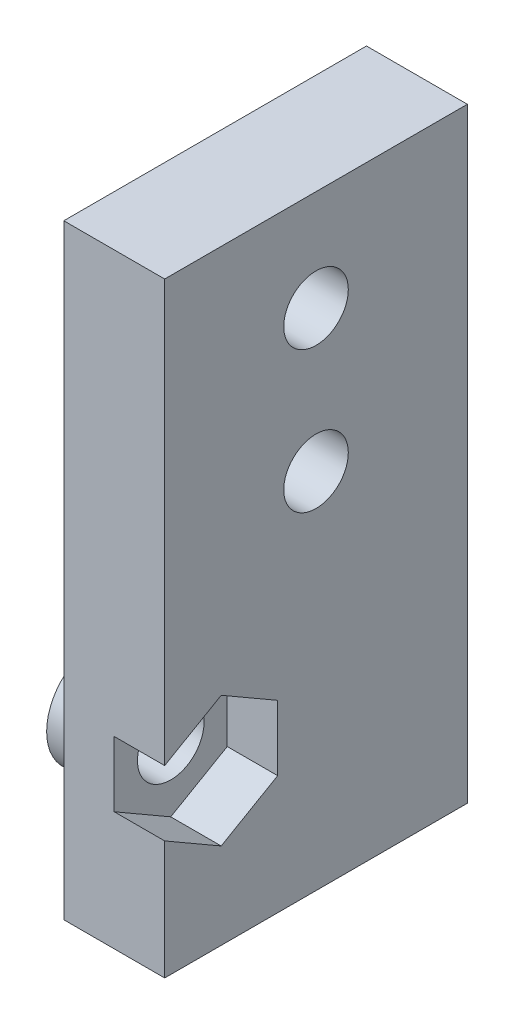
from build123d import *
from build123d.topology import SkipClean

# Parameters (mm, degrees)
SKETCH1_R           = 1.6
BOSS_EXTRUDE1_DEPTH = 2.5
BOSS_EXTRUDE2_START = -2.5
SKETCH1_3_R         = 1.6
SKETCH1_3_R_2       = 1.65
BOSS_EXTRUDE2_DEPTH = 2.5
BOSS_EXTRUDE3_START = 1
SKETCH4_R           = 2.65
SKETCH4_R_2         = 1.65
BOSS_EXTRUDE3_DEPTH = 1


with BuildPart() as part:
    # Sketch1 → Boss-Extrude1 (new body)
    with BuildSketch(Plane(origin=(0, 0, 0), x_dir=(0, 0, -1), z_dir=(1, 0, 0))):
        Polygon((0, 5.883419246), (0, 0), (15, 0), (15, 30), (0, 30), (0, 9.116580754), (2.8, 10.733161507), (5.6, 9.116580754), (5.6, 5.883419246), (2.8, 4.266838493), align=None)
        with Locations((7.5, 18)):
            Circle(SKETCH1_R, mode=Mode.SUBTRACT)
        with Locations((7.5, 25)):
            Circle(SKETCH1_R, mode=Mode.SUBTRACT)
    extrude(amount=BOSS_EXTRUDE1_DEPTH)

    # Sketch1<3> → Boss-Extrude2 (add)
    # profile 1 of 7: a face of its own
    with SkipClean():  # the faces are left unmerged after this step: merging them gives an invalid solid
        with BuildSketch(Plane(origin=(0, 0, 0), x_dir=(0, 0, -1), z_dir=(1, 0, 0)).offset(BOSS_EXTRUDE2_START)):
            Polygon((0, 5.883419246), (0, 0), (15, 0), (15, 30), (0, 30), (0, 9.116580754), (2.8, 10.733161507), (5.6, 9.116580754), (5.6, 5.883419246), (2.8, 4.266838493), align=None)
            with Locations((7.5, 7.5)):
                Circle(SKETCH1_3_R, mode=Mode.SUBTRACT)
            with BuildLine():
                ThreePointArc((6.2510004, 19), (6.970094046, 21.509701851), (9.1, 20))
                ThreePointArc((9.1, 20), (9.009701851, 19.470094046), (8.7489996, 19))
                ThreePointArc((8.7489996, 19), (9.009701851, 18.529905954), (9.1, 18))
                ThreePointArc((9.1, 18), (6.970094046, 16.490298149), (6.2510004, 19))
            make_face(mode=Mode.SUBTRACT)
            with Locations((7.5, 25)):
                Circle(SKETCH1_3_R, mode=Mode.SUBTRACT)
        # profile 2 of 7: a face of its own
        with BuildSketch(Plane(origin=(0, 0, 0), x_dir=(0, 0, -1), z_dir=(1, 0, 0)).offset(BOSS_EXTRUDE2_START)):
            Polygon((0, 5.883419246), (0, 0), (15, 0), (15, 30), (0, 30), (0, 9.116580754), (2.8, 10.733161507), (5.6, 9.116580754), (5.6, 5.883419246), (2.8, 4.266838493), align=None)
            with Locations((7.5, 7.5)):
                Circle(SKETCH1_3_R, mode=Mode.SUBTRACT)
            with BuildLine():
                ThreePointArc((6.2510004, 19), (6.970094046, 21.509701851), (9.1, 20))
                ThreePointArc((9.1, 20), (9.009701851, 19.470094046), (8.7489996, 19))
                ThreePointArc((8.7489996, 19), (9.009701851, 18.529905954), (9.1, 18))
                ThreePointArc((9.1, 18), (6.970094046, 16.490298149), (6.2510004, 19))
            make_face(mode=Mode.SUBTRACT)
            with Locations((7.5, 25)):
                Circle(SKETCH1_3_R, mode=Mode.SUBTRACT)
        # profile 3 of 7: a face of its own
        with BuildSketch(Plane(origin=(0, 0, 0), x_dir=(0, 0, -1), z_dir=(1, 0, 0)).offset(BOSS_EXTRUDE2_START)):
            Polygon((0, 9.116580754), (0, 5.883419246), (2.8, 4.266838493), (5.6, 5.883419246), (5.6, 9.116580754), (2.8, 10.733161507), align=None)
            with Locations((2.8, 7.5)):
                Circle(SKETCH1_3_R_2, mode=Mode.SUBTRACT)
        # profile 4 of 7: a face of its own
        with BuildSketch(Plane(origin=(0, 0, 0), x_dir=(0, 0, -1), z_dir=(1, 0, 0)).offset(BOSS_EXTRUDE2_START)):
            with Locations((7.5, 7.5)):
                Circle(SKETCH1_3_R)
        # profile 5 of 7: a face of its own
        with BuildSketch(Plane(origin=(0, 0, 0), x_dir=(0, 0, -1), z_dir=(1, 0, 0)).offset(BOSS_EXTRUDE2_START)):
            with Locations((7.5, 7.5)):
                Circle(SKETCH1_3_R)
        # profile 6 of 7: a face of its own
        with BuildSketch(Plane(origin=(0, 0, 0), x_dir=(0, 0, -1), z_dir=(1, 0, 0)).offset(BOSS_EXTRUDE2_START)):
            with BuildLine():
                ThreePointArc((8.7489996, 19), (9.009701851, 19.470094046), (9.1, 20))
                ThreePointArc((9.1, 20), (6.970094046, 21.509701851), (6.2510004, 19))
                ThreePointArc((6.2510004, 19), (7.5, 19.6), (8.7489996, 19))
            make_face()
        # profile 7 of 7: a face of its own
        with BuildSketch(Plane(origin=(0, 0, 0), x_dir=(0, 0, -1), z_dir=(1, 0, 0)).offset(BOSS_EXTRUDE2_START)):
            with BuildLine():
                ThreePointArc((8.7489996, 19), (9.009701851, 19.470094046), (9.1, 20))
                ThreePointArc((9.1, 20), (6.970094046, 21.509701851), (6.2510004, 19))
                ThreePointArc((6.2510004, 19), (7.5, 19.6), (8.7489996, 19))
            make_face()
        extrude(amount=BOSS_EXTRUDE2_DEPTH)

    # Sketch4 → Boss-Extrude3 (add)
    with BuildSketch(Plane.ZY.offset(2.5).offset(BOSS_EXTRUDE3_START)):
        with Locations(Location((-2.8, 7.5, 0), (0, 0, 180))):
            Circle(SKETCH4_R)
        with Locations(Location((-2.8, 7.5, 0), (0, 0, 180))):
            Circle(SKETCH4_R_2, mode=Mode.SUBTRACT)
    extrude(amount=-BOSS_EXTRUDE3_DEPTH)


solid = part.part
